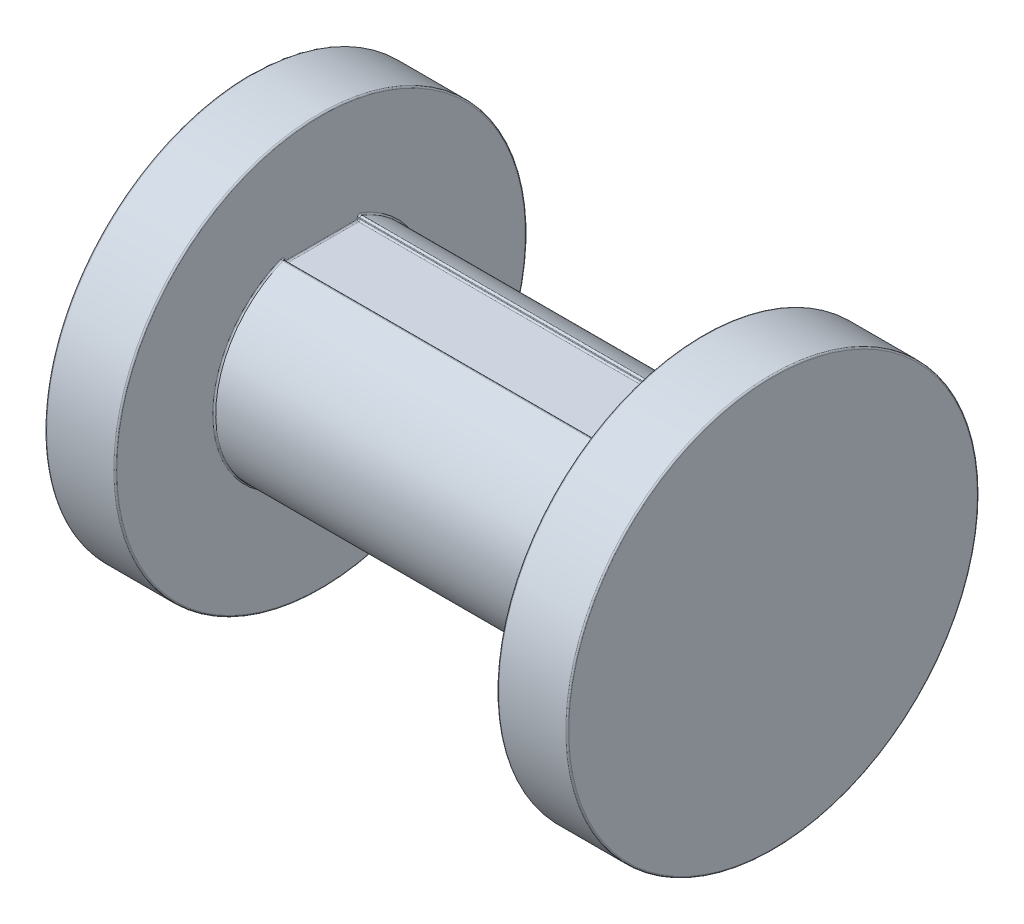
from build123d import *

# Parameters (mm, degrees)
SKETCH4_R               = 21.7
BOSS_EXTRUDE5_DEPTH     = 53.02
CUT_EXTRUDE1_DEPTH      = 111.391401839
CUT_EXTRUDE1_DEPTH_BACK = 111.391401839
SKETCH5_R               = 41.8
BOSS_EXTRUDE6_DEPTH     = 14.24
FILLET1_R               = 0.3


with BuildPart() as part:
    # Sketch4 → Boss-Extrude5 (new, symmetric)
    with BuildSketch(Plane(origin=(0, 0, 0), x_dir=(0, 0, -1), z_dir=(1, 0, 0))):
        with Locations(Location((0, 0, 0), (0, 0, 180))):
            Circle(SKETCH4_R)
    extrude(amount=BOSS_EXTRUDE5_DEPTH, both=True)

    # Sketch6 → Cut-Extrude1 (cut, two sides: drawn at the far end of the back side and taken through both)
    with BuildSketch(Plane(origin=(53.02, 0, 0), x_dir=(0, 0, -1), z_dir=(1, 0, 0)).offset(-CUT_EXTRUDE1_DEPTH_BACK)):
        with BuildLine():
            Line((-7.63, 20.314356992), (-7.63, 19.346381851))
            Line((-7.63, 19.346381851), (7.63, 19.346381851))
            Line((7.63, 19.346381851), (7.63, 20.314356992))
            ThreePointArc((7.63, 20.314356992), (0, 21.7), (-7.63, 20.314356992))
        make_face()
    extrude(amount=CUT_EXTRUDE1_DEPTH + CUT_EXTRUDE1_DEPTH_BACK, mode=Mode.SUBTRACT)

    # Sketch5 → Boss-Extrude6 (add)
    with BuildSketch(Plane(origin=(53.02, 0, 0), x_dir=(0, 0, -1), z_dir=(1, 0, 0))):
        Circle(SKETCH5_R)
    boss_extrude6 = extrude(amount=-BOSS_EXTRUDE6_DEPTH)

    # Mirror3: Boss-Extrude6 across plane
    add(boss_extrude6.mirror(Plane(origin=(0, 0, 0), x_dir=(0, 0, 1), z_dir=(1, 0, 0))))

    # Fillet1
    fillet1_edges = [part.edges().sort_by_distance(p)[0] for p in [
        (38.78, 19.830369422, 7.63),
        (38.78, -21.7, 0),
        (38.78, 19.830369422, -7.63),
        (38.78, 19.346381851, 0),
        (53.02, 0, 41.8),
        (38.78, 0, 41.8),
        (0, 19.346381851, 7.63),
        (0, 20.314356992, 7.63),
        (-38.78, 19.830369422, 7.63),
        (0, 19.346381851, -7.63),
        (0, 20.314356992, -7.63),
        (-38.78, 0, 41.8),
        (-38.78, 19.830369422, -7.63),
        (-38.78, -21.7, 0),
        (-38.78, 19.346381851, 0),
        (-53.02, 0, 41.8),
    ]]
    fillet(fillet1_edges, radius=FILLET1_R)


solid = part.part
